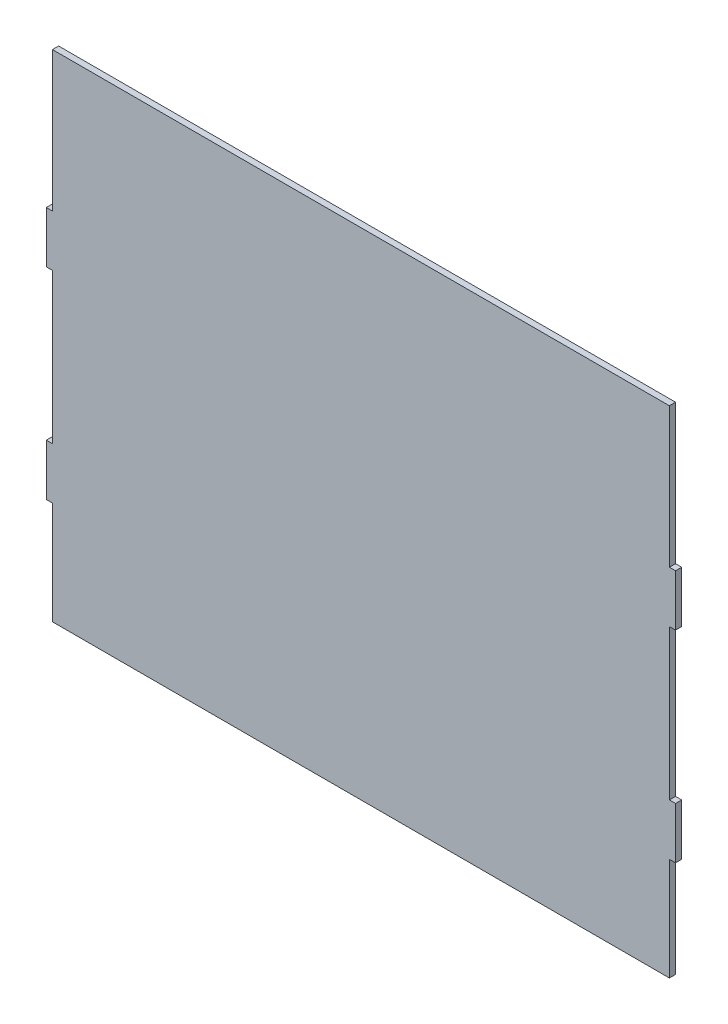
from build123d import *

# Parameters (mm, degrees)
BOSS_EXTRUDE1_DEPTH = 6


with BuildPart() as part:
    # Sketch1 → Boss-Extrude1 (new body)
    with BuildSketch(Plane.XY):
        Polygon((-300, 241), (300, 241), (300, 105), (306, 105), (306, 55), (300, 55), (300, -91), (306, -91), (306, -141), (300, -141), (300, -241), (-300, -241), (-300, -141), (-306, -141), (-306, -91), (-300, -91), (-300, 55), (-306, 55), (-306, 105), (-300, 105), align=None)
    extrude(amount=BOSS_EXTRUDE1_DEPTH)


solid = part.part
